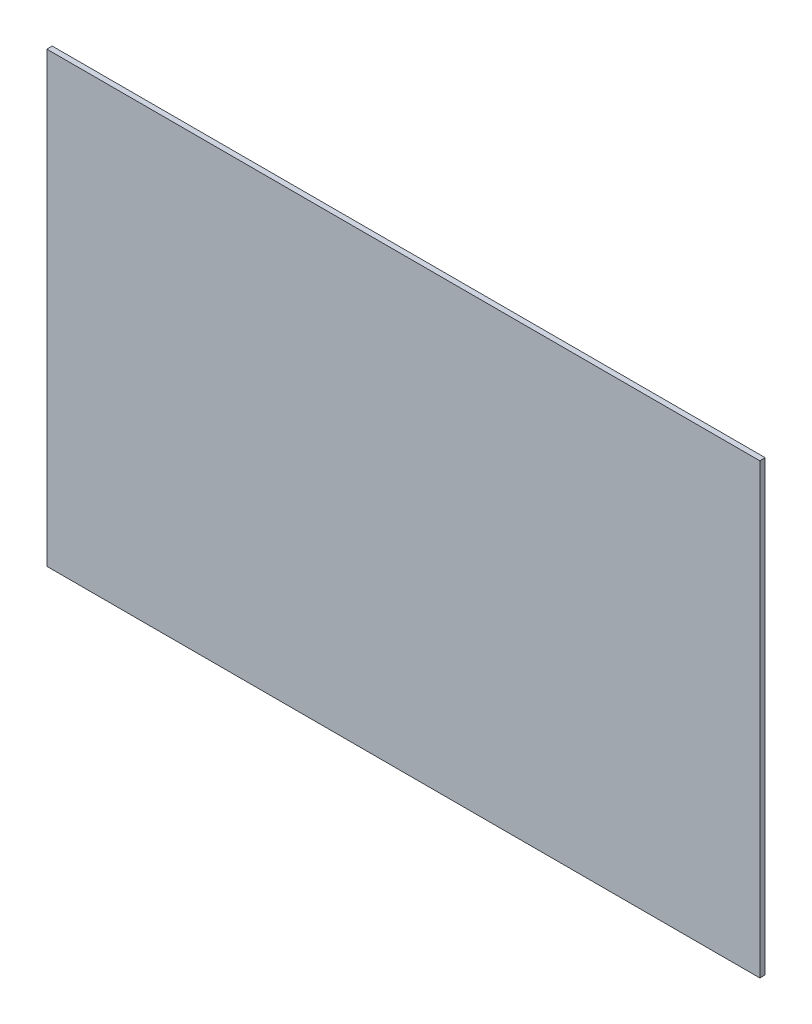
from build123d import *

# Parameters (mm, degrees)
SKETCH1_W           = 398
SKETCH1_H           = 250
BOSS_EXTRUDE1_DEPTH = 3


with BuildPart() as part:
    # Sketch1 → Boss-Extrude1 (new body)
    with BuildSketch(Plane.XY):
        with Locations((-199, 125)):
            Rectangle(SKETCH1_W, SKETCH1_H)
    extrude(amount=BOSS_EXTRUDE1_DEPTH)


solid = part.part
